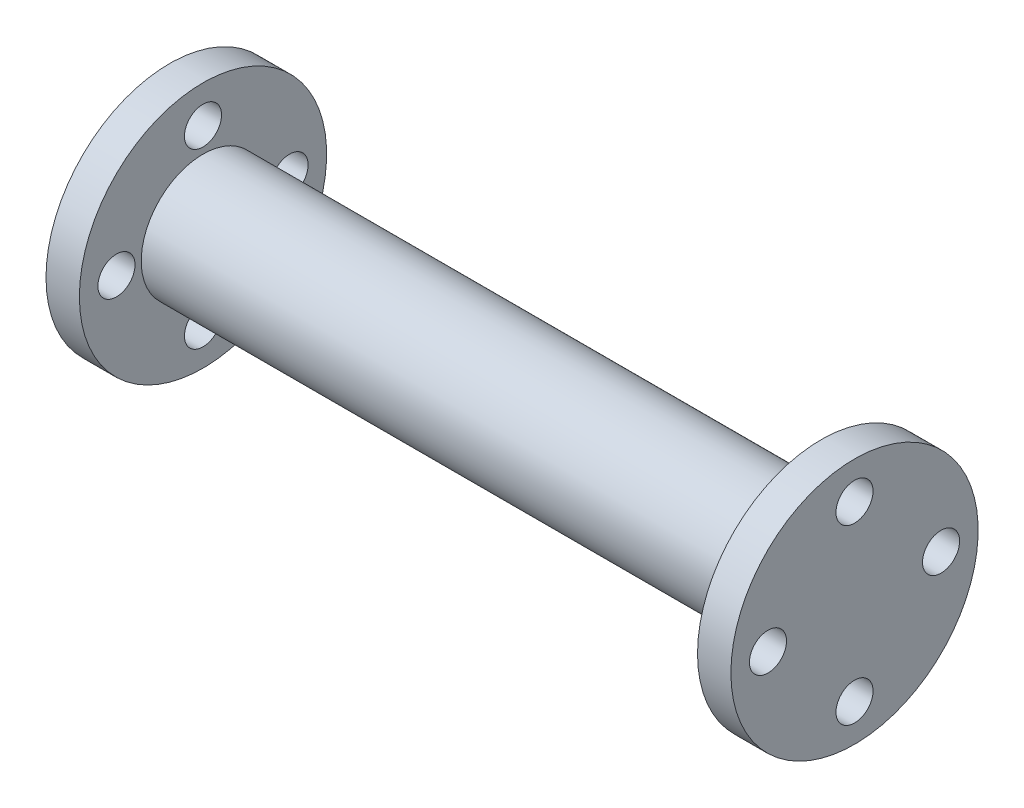
from build123d import *

# Parameters (mm, degrees)
CROQUIS1_R              = 10
SALIENTE_EXTRUIR1_DEPTH = 2.7
CROQUIS2_R              = 5
SALIENTE_EXTRUIR2_DEPTH = 50
CROQUIS3_R              = 10
SALIENTE_EXTRUIR3_DEPTH = 2.7
CROQUIS5_R              = 1.5
CORTAR_EXTRUIR1_DEPTH   = 60


with BuildPart() as part:
    # Croquis1 → Saliente-Extruir1 (new body)
    with BuildSketch(Plane(origin=(0, 0, 0), x_dir=(0, 0, -1), z_dir=(1, 0, 0))):
        with Locations(Location((0, 0, 0), (0, 0, 180))):
            Circle(CROQUIS1_R)
    extrude(amount=SALIENTE_EXTRUIR1_DEPTH)

    # Croquis2 → Saliente-Extruir2 (add)
    with BuildSketch(Plane(origin=(2.7, 0, 0), x_dir=(0, 0, -1), z_dir=(1, 0, 0))):
        Circle(CROQUIS2_R)
    extrude(amount=SALIENTE_EXTRUIR2_DEPTH)

    # Croquis3 → Saliente-Extruir3 (add)
    with BuildSketch(Plane(origin=(52.7, 0, 0), x_dir=(0, 0, -1), z_dir=(1, 0, 0))):
        with Locations(Location((0, 0, 0), (0, 0, 180))):
            Circle(CROQUIS3_R)
    extrude(amount=SALIENTE_EXTRUIR3_DEPTH)

    # Croquis5 → Cortar-Extruir1 (cut)
    with BuildSketch(Plane(origin=(55.4, 0, 0), x_dir=(0, 0, -1), z_dir=(1, 0, 0))):
        with Locations((0, 7)):
            Circle(CROQUIS5_R)
        with Locations((7, 0)):
            Circle(CROQUIS5_R)
        with Locations((0, -7)):
            Circle(CROQUIS5_R)
        with Locations((-7, 0)):
            Circle(CROQUIS5_R)
    extrude(amount=-CORTAR_EXTRUIR1_DEPTH, mode=Mode.SUBTRACT)


solid = part.part
